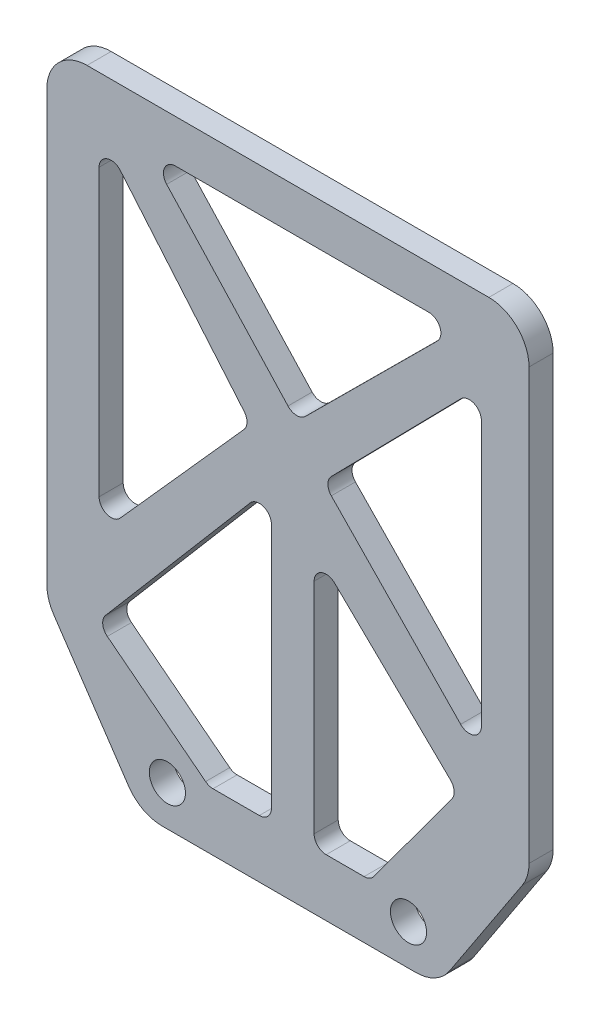
from build123d import *

# Parameters (mm, degrees)
SKETCH_1_W          = 60
SKETCH_1_H          = 77.3
SKETCH_1_R          = 2.25
EXTRUDE_1_DEPTH     = 3
CUT_EXTRUDE_1_DEPTH = 98.899387128
FILLET_2_R          = 1.5
FILLET_3_R          = 5


with BuildPart() as part:
    # 草图1 → 凸台-拉伸1 (new body)
    with BuildSketch(Plane.XY):
        with Locations((30, 38.65)):
            Rectangle(SKETCH_1_W, SKETCH_1_H)
        with Locations((15, 5)):
            Circle(SKETCH_1_R, mode=Mode.SUBTRACT)
        with Locations((45, 5)):
            Circle(SKETCH_1_R, mode=Mode.SUBTRACT)
    extrude(amount=EXTRUDE_1_DEPTH)

    # 草图2 → 切除-拉伸1 (cut, through all)
    with BuildSketch(Plane.XY.offset(3)):
        Polygon((6.498142721, 71.177419939), (25.390067515, 48.791389416), (6.498142721, 27.629402774), align=None)
        Polygon((12.580592965, 71.956095933), (51.165829297, 71.956095933), (31.061830901, 51.954660702), align=None)
        Polygon((54.068167093, 67.235159515), (34.375406047, 47.16148119), (54.068167093, 26.885410871), align=None)
        Polygon((27.938555498, 43.399685415), (6.287330924, 17.986665065), (20.160366982, 7.184410962), (27.938555498, 7.184410962), align=None)
        Polygon((33.25628143, 39.393281631), (33.25628143, 7.119255047), (40.235291957, 7.119255047), (51.165829297, 21.999247226), align=None)
        Polygon((0, 17.3), (11.665719773, 0), (0, 0), align=None)
        Polygon((60, 17.3), (48.617435134, 0), (60, 0), align=None)
    extrude(amount=-CUT_EXTRUDE_1_DEPTH, mode=Mode.SUBTRACT)

    # 圆角2
    fillet_2_edges = [part.edges().sort_by_distance(p)[0] for p in [
        (6.498142721, 27.629402774, 1.5),
        (6.498142721, 71.177419939, 1.5),
        (25.390067515, 48.791389416, 1.5),
        (31.061830901, 51.954660702, 1.5),
        (12.580592965, 71.956095933, 1.5),
        (51.165829297, 71.956095933, 1.5),
        (27.938555498, 43.399685415, 1.5),
        (27.938555498, 7.184410962, 1.5),
        (20.160366982, 7.184410962, 1.5),
        (6.287330924, 17.986665065, 1.5),
        (40.235291957, 7.119255047, 1.5),
        (33.25628143, 7.119255047, 1.5),
        (33.25628143, 39.393281631, 1.5),
        (51.165829297, 21.999247226, 1.5),
        (54.068167093, 67.235159515, 1.5),
        (54.068167093, 26.885410871, 1.5),
        (34.375406047, 47.16148119, 1.5),
    ]]
    fillet(fillet_2_edges, radius=FILLET_2_R)

    # 圆角3
    fillet_3_edges = [part.edges().sort_by_distance(p)[0] for p in [
        (0, 17.3, 1.5),
        (11.665719773, 0, 1.5),
        (0, 77.3, 1.5),
        (60, 17.3, 1.5),
        (60, 77.3, 1.5),
        (48.617435134, 0, 1.5),
    ]]
    fillet(fillet_3_edges, radius=FILLET_3_R)


solid = part.part
